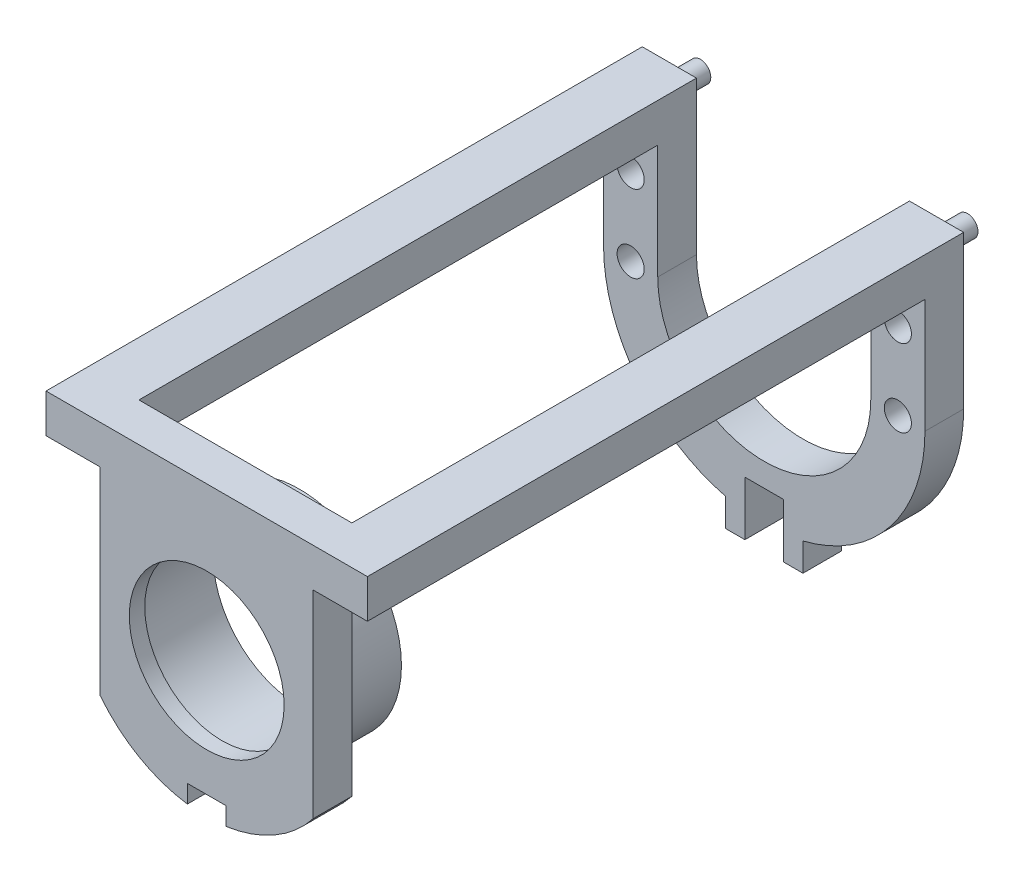
from build123d import *

# Parameters (mm, degrees)
SKETCH1_R           = 1.75
BOSS_EXTRUDE1_DEPTH = 5
SKETCH2_R           = 1.35
BOSS_EXTRUDE2_DEPTH = 4
SKETCH4_W           = 7
SKETCH4_H           = 5
BOSS_EXTRUDE3_DEPTH = 72
SKETCH5_R           = 10
BOSS_EXTRUDE4_DEPTH = 5
SKETCH6_R           = 13.15
SKETCH6_R_2         = 11.15
BOSS_EXTRUDE5_DEPTH = 7
CUT_EXTRUDE1_START  = -3
SKETCH7_R           = 11.15
CUT_EXTRUDE1_DEPTH  = 3
CUT_EXTRUDE2_DEPTH  = 5


with BuildPart() as part:
    # Sketch1 → Boss-Extrude1 (new body)
    with BuildSketch(Plane.XY):
        with BuildLine():
            Line((-13.753194099, 0), (-13.753194099, 19.75))
            Line((-13.753194099, 19.75), (-20.753194099, 19.75))
            Line((-20.753194099, 19.75), (-20.753194099, 0))
            ThreePointArc((-20.753194099, 0), (-16.34718685, -12.785325472), (-5, -20.141873431))
            Line((-5, -20.141873431), (-5, -23.753194099))
            Line((-5, -23.753194099), (-2.5, -23.753194099))
            Line((-2.5, -23.753194099), (-2.5, -16.753194099))
            Line((-2.5, -16.753194099), (2.5, -16.753194099))
            Line((2.5, -16.753194099), (2.5, -23.753194099))
            Line((2.5, -23.753194099), (5, -23.753194099))
            Line((5, -23.753194099), (5, -20.141873431))
            ThreePointArc((5, -20.141873431), (16.34718685, -12.785325472), (20.753194099, 0))
            Line((20.753194099, 0), (20.753194099, 19.75))
            Line((20.753194099, 19.75), (13.753194099, 19.75))
            Line((13.753194099, 19.75), (13.753194099, 0))
            ThreePointArc((13.753194099, 0), (0, -13.753194099), (-13.753194099, 0))
        make_face()
        with Locations((-17.253194099, 0)):
            Circle(SKETCH1_R, mode=Mode.SUBTRACT)
        with Locations((-17.253194099, 10)):
            Circle(SKETCH1_R, mode=Mode.SUBTRACT)
        with Locations((17.253194099, 10)):
            Circle(SKETCH1_R, mode=Mode.SUBTRACT)
        with Locations((17.253194099, 0)):
            Circle(SKETCH1_R, mode=Mode.SUBTRACT)
    extrude(amount=BOSS_EXTRUDE1_DEPTH)

    # Sketch2 → Boss-Extrude2 (add)
    with BuildSketch(Plane(origin=(0, 0, 0), x_dir=(-1, 0, 0), z_dir=(0, 0, -1))):
        with Locations(Location((-17.253194099, 16.75, 0), (0, 0, 180))):
            Circle(SKETCH2_R)
        with Locations(Location((17.253194099, 16.75, 0), (0, 0, 180))):
            Circle(SKETCH2_R)
    extrude(amount=BOSS_EXTRUDE2_DEPTH)

    # Sketch4 → Boss-Extrude3 (add)
    with BuildSketch(Plane.XY.offset(5)):
        with Locations((-17.253194099, 17.25)):
            Rectangle(SKETCH4_W, SKETCH4_H)
        with Locations((17.253194099, 17.25)):
            Rectangle(SKETCH4_W, SKETCH4_H)
    extrude(amount=BOSS_EXTRUDE3_DEPTH)

    # Sketch5 → Boss-Extrude4 (add)
    with BuildSketch(Plane.XY.offset(77)):
        with BuildLine():
            Line((-13.753194099, 19.75), (-13.753194099, 14.75))
            Line((-13.753194099, 14.75), (-13.753194099, -10.821259264))
            ThreePointArc((-13.753194099, -10.821259264), (0, -17.5), (13.753194099, -10.821259264))
            Line((13.753194099, -10.821259264), (13.753194099, 14.75))
            Line((13.753194099, 14.75), (13.753194099, 19.75))
            Line((13.753194099, 19.75), (-13.753194099, 19.75))
        make_face()
        Circle(SKETCH5_R, mode=Mode.SUBTRACT)
    extrude(amount=-BOSS_EXTRUDE4_DEPTH)

    # Sketch6 → Boss-Extrude5 (add)
    with BuildSketch(Plane(origin=(0, 0, 72), x_dir=(-1, 0, 0), z_dir=(0, 0, -1))):
        with Locations(Location((0, 0, 0), (0, 0, 180))):
            Circle(SKETCH6_R)
        Circle(SKETCH6_R_2, mode=Mode.SUBTRACT)
    extrude(amount=BOSS_EXTRUDE5_DEPTH)

    # Sketch7 → Cut-Extrude1 (cut)
    with BuildSketch(Plane(origin=(0, 0, 72), x_dir=(-1, 0, 0), z_dir=(0, 0, -1)).offset(CUT_EXTRUDE1_START)):
        Circle(SKETCH7_R)
    extrude(amount=CUT_EXTRUDE1_DEPTH, mode=Mode.SUBTRACT)

    # Sketch8 → Cut-Extrude2 (cut)
    with BuildSketch(Plane.XY.offset(77)):
        with BuildLine():
            Line((2.5, -17.320508076), (2.5, -15))
            Line((2.5, -15), (-2.5, -15))
            Line((-2.5, -15), (-2.5, -17.320508076))
            ThreePointArc((-2.5, -17.320508076), (0, -17.5), (2.5, -17.320508076))
        make_face()
    extrude(amount=-CUT_EXTRUDE2_DEPTH, mode=Mode.SUBTRACT)


solid = part.part
